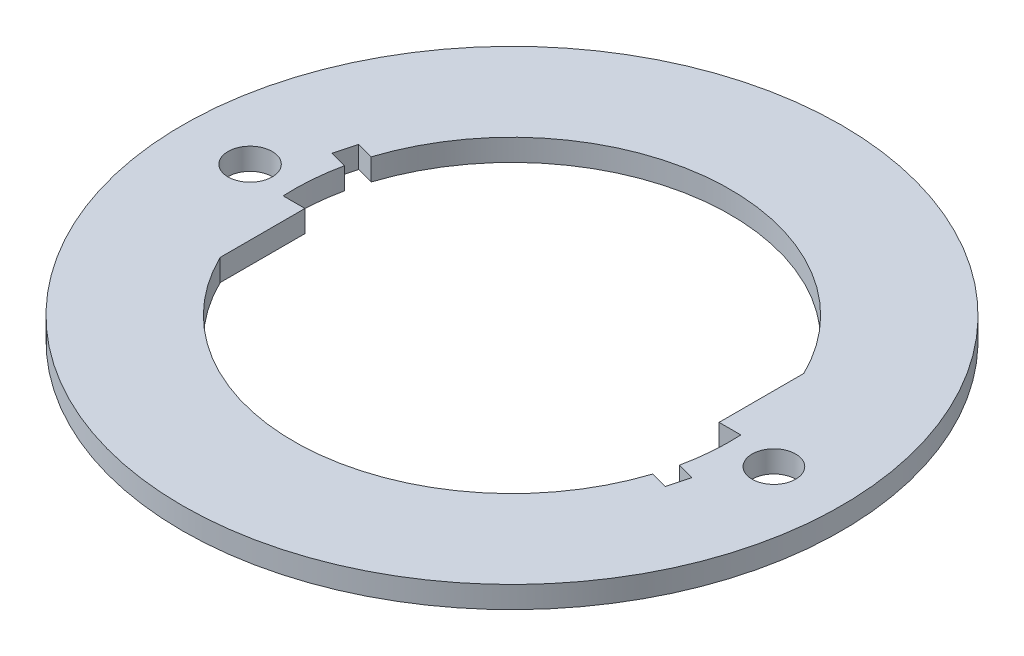
from build123d import *

# Parameters (mm, degrees)
SKETCH1_R           = 47.9425
SKETCH1_R_2         = 3.2131
SKETCH1_R_3         = 3.175
BOSS_EXTRUDE1_DEPTH = 3.175
CUT_EXTRUDE1_DEPTH  = 68.875232873


with BuildPart() as part:
    # Sketch1 → Boss-Extrude1 (new body)
    with BuildSketch(Plane(origin=(0, 0, 0), x_dir=(1, 0, 0), z_dir=(0, 1, 0))):
        Circle(SKETCH1_R)
        with Locations((-38.1, 0)):
            Circle(SKETCH1_R_2, mode=Mode.SUBTRACT)
        with Locations((38.1, 0)):
            Circle(SKETCH1_R_3, mode=Mode.SUBTRACT)
        with BuildLine():
            Line((-31.710287664, -1.5875), (-28.535287664, -1.5875))
            Line((-28.535287664, -1.5875), (-28.535287664, -13.921201741))
            ThreePointArc((-28.535287664, -13.921201741), (7.915182479, -30.74755903), (31.710287664, 1.5875))
            Line((31.710287664, 1.5875), (28.535287664, 1.5875))
            Line((28.535287664, 1.5875), (28.535287664, 13.921201741))
            ThreePointArc((28.535287664, 13.921201741), (-7.915182479, 30.74755903), (-31.710287664, -1.5875))
        make_face(mode=Mode.SUBTRACT)
    extrude(amount=BOSS_EXTRUDE1_DEPTH)

    # Sketch2 → Cut-Extrude1 (cut, through all)
    with BuildSketch(Plane(origin=(0, 3.175, 0), x_dir=(1, 0, 0), z_dir=(0, 1, 0))):
        Polygon((-32.710721349, 10.408312306), (-33.532471818, 7.341497807), (32.710721349, -10.408312306), (33.532471818, -7.341497807), align=None)
    extrude(amount=-CUT_EXTRUDE1_DEPTH, mode=Mode.SUBTRACT)


solid = part.part
